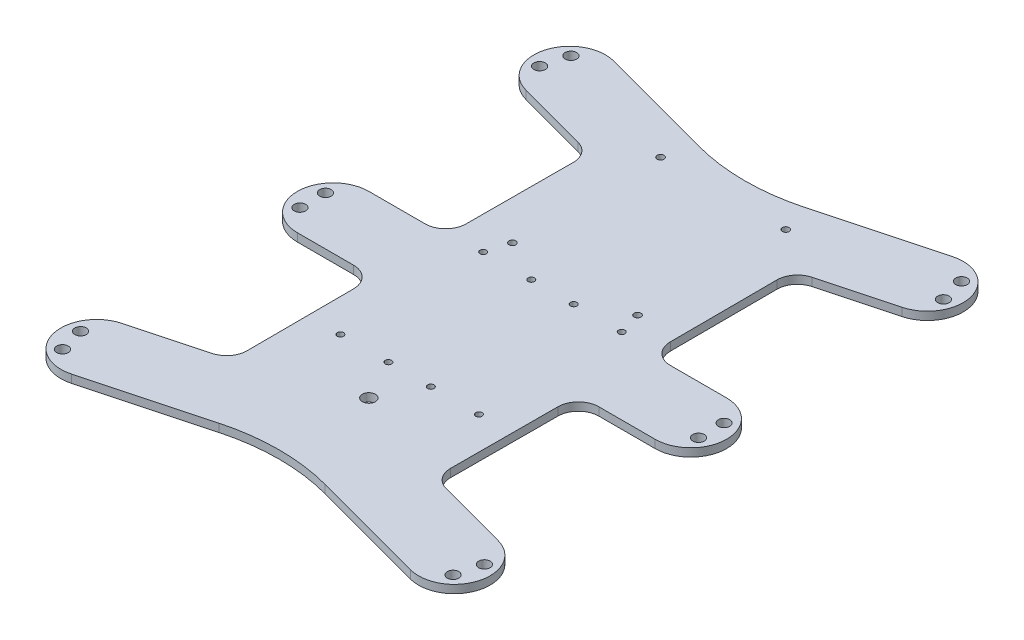
from build123d import *

# Parameters (mm, degrees)
BOSS_EXTRUDE1_DEPTH = 3.175
FILLET1_R           = 80
FILLET2_R           = 8
SKETCH2_R           = 1.35
CUT_EXTRUDE1_DEPTH  = 136.741386774
SKETCH3_R           = 1.25
CUT_EXTRUDE2_DEPTH  = 136.741386774
SKETCH5_R           = 2.55
CUT_EXTRUDE3_DEPTH  = 136.741386774
SKETCH7_R           = 2.25
CUT_EXTRUDE4_DEPTH  = 10


with BuildPart() as part:
    # Sketch1 → Boss-Extrude1 (new body)
    with BuildSketch(Plane(origin=(0, 0, 0), x_dir=(1, 0, 0), z_dir=(0, 1, 0))):
        with BuildLine():
            Line((-70, 14), (-40, 14))
            Line((-40, 14), (-39.816062711, 70))
            Line((-39.816062711, 70), (-73.623466631, 79.058666579))
            ThreePointArc((-73.623466631, 79.058666579), (-83.522961568, 96.205094778), (-66.376533369, 106.104589715))
            Line((-66.376533369, 106.104589715), (0, 88.319051202))
            Line((0, 88.319051202), (66.376533369, 106.104589715))
            ThreePointArc((66.376533369, 106.104589715), (83.522961568, 96.205094778), (73.623466631, 79.058666579))
            Line((73.623466631, 79.058666579), (39.816062711, 70))
            Line((39.816062711, 70), (40, 14))
            Line((40, 14), (70, 14))
            ThreePointArc((70, 14), (84, 0), (70, -14))
            Line((70, -14), (40, -14))
            Line((40, -14), (39.816062711, -70))
            Line((39.816062711, -70), (73.623466631, -79.058666579))
            ThreePointArc((73.623466631, -79.058666579), (83.522961568, -96.205094778), (66.376533369, -106.104589715))
            Line((66.376533369, -106.104589715), (0, -88.319051202))
            Line((0, -88.319051202), (-66.376533369, -106.104589715))
            ThreePointArc((-66.376533369, -106.104589715), (-83.522961568, -96.205094778), (-73.623466631, -79.058666579))
            Line((-73.623466631, -79.058666579), (-39.816062711, -70))
            Line((-39.816062711, -70), (-40, -14))
            Line((-40, -14), (-70, -14))
            ThreePointArc((-70, -14), (-84, 0), (-70, 14))
        make_face()
    extrude(amount=BOSS_EXTRUDE1_DEPTH)

    # Fillet1
    fillet1_edges = [part.edges().sort_by_distance(p)[0] for p in [
        (0, 1.5875, -88.319051202),
        (0, 1.5875, 88.319051202),
    ]]
    fillet(fillet1_edges, radius=FILLET1_R)

    # Fillet2
    fillet2_edges = [part.edges().sort_by_distance(p)[0] for p in [
        (-40, 1.5875, -14),
        (-39.816062711, 1.5875, -70),
        (39.816062711, 1.5875, -70),
        (40, 1.5875, -14),
        (40, 1.5875, 14),
        (39.816062711, 1.5875, 70),
        (-39.816062711, 1.5875, 70),
        (-40, 1.5875, 14),
    ]]
    fillet(fillet2_edges, radius=FILLET2_R)

    # Sketch2 → Cut-Extrude1 (cut, through all)
    with BuildSketch(Plane(origin=(0, 3.175, 0), x_dir=(1, 0, 0), z_dir=(0, 1, 0))):
        with Locations(Location((-24.5, 24.641145635, 0), (0, 0, 270))):
            Circle(SKETCH2_R)
        with Locations(Location((24.5, 24.641145635, 0), (0, 0, 270))):
            Circle(SKETCH2_R)
        with Locations(Location((24.5, 82.641145635, 0), (0, 0, 270))):
            Circle(SKETCH2_R)
        with Locations(Location((-24.5, 82.641145635, 0), (0, 0, 270))):
            Circle(SKETCH2_R)
    extrude(amount=-CUT_EXTRUDE1_DEPTH, mode=Mode.SUBTRACT)

    # Sketch3 → Cut-Extrude2 (cut, through all)
    with BuildSketch(Plane(origin=(0, 3.175, 0), x_dir=(1, 0, 0), z_dir=(0, 1, 0))):
        with Locations(Location((-8.3, -40.058854365, 0), (0, 0, 270))):
            Circle(SKETCH3_R)
        with Locations(Location((-27.1, -40.058854365, 0), (0, 0, 270))):
            Circle(SKETCH3_R)
        with Locations(Location((-27.1, 15.841145635, 0), (0, 0, 270))):
            Circle(SKETCH3_R)
        with Locations(Location((-8.3, 15.841145635, 0), (0, 0, 270))):
            Circle(SKETCH3_R)
        with Locations(Location((8.3, 15.841145635, 0), (0, 0, 270))):
            Circle(SKETCH3_R)
        with Locations(Location((27.1, 15.841145635, 0), (0, 0, 270))):
            Circle(SKETCH3_R)
        with Locations(Location((8.3, -40.058854365, 0), (0, 0, 270))):
            Circle(SKETCH3_R)
        with Locations(Location((27.1, -40.058854365, 0), (0, 0, 270))):
            Circle(SKETCH3_R)
    extrude(amount=-CUT_EXTRUDE2_DEPTH, mode=Mode.SUBTRACT)

    # Sketch5 → Cut-Extrude3 (cut, through all)
    with BuildSketch(Plane(origin=(0, 3.175, 0), x_dir=(1, 0, 0), z_dir=(0, 1, 0))):
        with Locations(Location((0, -56.018854365, 0), (0, 0, 270))):
            Circle(SKETCH5_R)
    extrude(amount=-CUT_EXTRUDE3_DEPTH, mode=Mode.SUBTRACT)

    # Sketch7 → Cut-Extrude4 (cut)
    with BuildSketch(Plane(origin=(0, 3.175, 0), x_dir=(1, 0, 0), z_dir=(0, 1, 0))):
        with Locations(Location((-76.433311385, -99.481809639, 0), (0, 0, 270))):
            Circle(SKETCH7_R)
        with Locations(Location((-79.021501836, -89.822551376, 0), (0, 0, 270))):
            Circle(SKETCH7_R)
        with Locations(Location((-78, -5, 0), (0, 0, 270))):
            Circle(SKETCH7_R)
        with Locations(Location((-78, 5, 0), (0, 0, 270))):
            Circle(SKETCH7_R)
        with Locations(Location((-79.021501836, 89.822551376, 0), (0, 0, 270))):
            Circle(SKETCH7_R)
        with Locations(Location((-76.433311385, 99.481809639, 0), (0, 0, 270))):
            Circle(SKETCH7_R)
        with Locations(Location((79.021501836, 89.822551376, 0), (0, 0, 270))):
            Circle(SKETCH7_R)
        with Locations(Location((76.433311385, 99.481809639, 0), (0, 0, 270))):
            Circle(SKETCH7_R)
        with Locations(Location((78, -5, 0), (0, 0, 270))):
            Circle(SKETCH7_R)
        with Locations(Location((78, 5, 0), (0, 0, 270))):
            Circle(SKETCH7_R)
        with Locations(Location((79.021501836, -89.822551376, 0), (0, 0, 270))):
            Circle(SKETCH7_R)
        with Locations(Location((76.433311385, -99.481809639, 0), (0, 0, 270))):
            Circle(SKETCH7_R)
    extrude(amount=-CUT_EXTRUDE4_DEPTH, mode=Mode.SUBTRACT)


solid = part.part
